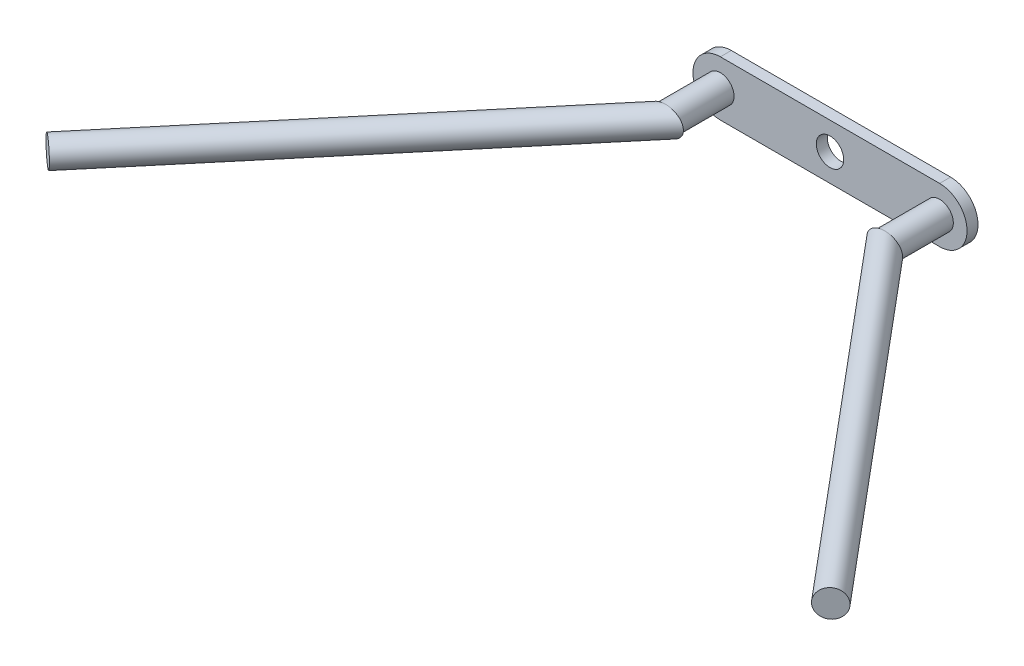
from build123d import *

# Parameters (mm, degrees)
SKETCH1_R           = 2.5
BOSS_EXTRUDE1_DEPTH = 2
SKETCH2_R           = 2.5
BOSS_EXTRUDE2_DEPTH = 10
BOSS_EXTRUDE3_REACH = 123.214
SKETCH4_R           = 2.5
BOSS_EXTRUDE4_REACH = 164.331
SKETCH5_R           = 2.5


with BuildPart() as part:
    # Sketch1 → Boss-Extrude1 (new body)
    with BuildSketch(Plane.XY):
        with BuildLine():
            Line((0, 5), (40, 5))
            ThreePointArc((40, 5), (45, 0), (40, -5))
            Line((40, -5), (0, -5))
            ThreePointArc((0, -5), (-5, 0), (0, 5))
        make_face()
        with Locations((20, 0)):
            Circle(SKETCH1_R, mode=Mode.SUBTRACT)
    extrude(amount=BOSS_EXTRUDE1_DEPTH)

    # Sketch2 → Boss-Extrude2 (add)
    with BuildSketch(Plane.XY.offset(2)):
        Circle(SKETCH2_R)
        with Locations((40, 0)):
            Circle(SKETCH2_R)
    extrude(amount=BOSS_EXTRUDE2_DEPTH)

    # Boss-Extrude3: up to this plane
    boss_extrude3_end = Plane(origin=(0, 0, 12), z_dir=(0, 0, 1))
    # Sketch4 → Boss-Extrude3 (add, up to the surface)
    with BuildSketch(Plane(origin=(-51.423008775, 0, 73.28355545), x_dir=(0.7660444431189768, 0, 0.6427876096865409), z_dir=(-0.6427876096865408, 0, 0.7660444431189767)), mode=Mode.PRIVATE) as boss_extrude3_sk1:
        Circle(SKETCH4_R)
    boss_extrude3_tool1 = split(extrude(boss_extrude3_sk1.sketch, amount=-BOSS_EXTRUDE3_REACH, mode=Mode.PRIVATE), bisect_by=boss_extrude3_end, keep=Keep.BOTH, mode=Mode.PRIVATE)
    add(boss_extrude3_tool1.solids().sort_by_distance((-51.423009, 0, 73.283555))[0])

    # Boss-Extrude4: up to this plane
    boss_extrude4_end = Plane(origin=(40, 0, 12), z_dir=(0, 0, 1))
    # Sketch5 → Boss-Extrude4 (add, up to the surface)
    with BuildSketch(Plane(origin=(91.423008775, 0, 73.28355545), x_dir=(0.7660444431189772, 0, -0.6427876096865404), z_dir=(0.6427876096865403, 0, 0.7660444431189771)), mode=Mode.PRIVATE) as boss_extrude4_sk1:
        Circle(SKETCH5_R)
    boss_extrude4_tool1 = split(extrude(boss_extrude4_sk1.sketch, amount=-BOSS_EXTRUDE4_REACH, mode=Mode.PRIVATE), bisect_by=boss_extrude4_end, keep=Keep.BOTH, mode=Mode.PRIVATE)
    add(boss_extrude4_tool1.solids().sort_by_distance((91.423009, 0, 73.283555))[0])


solid = part.part
